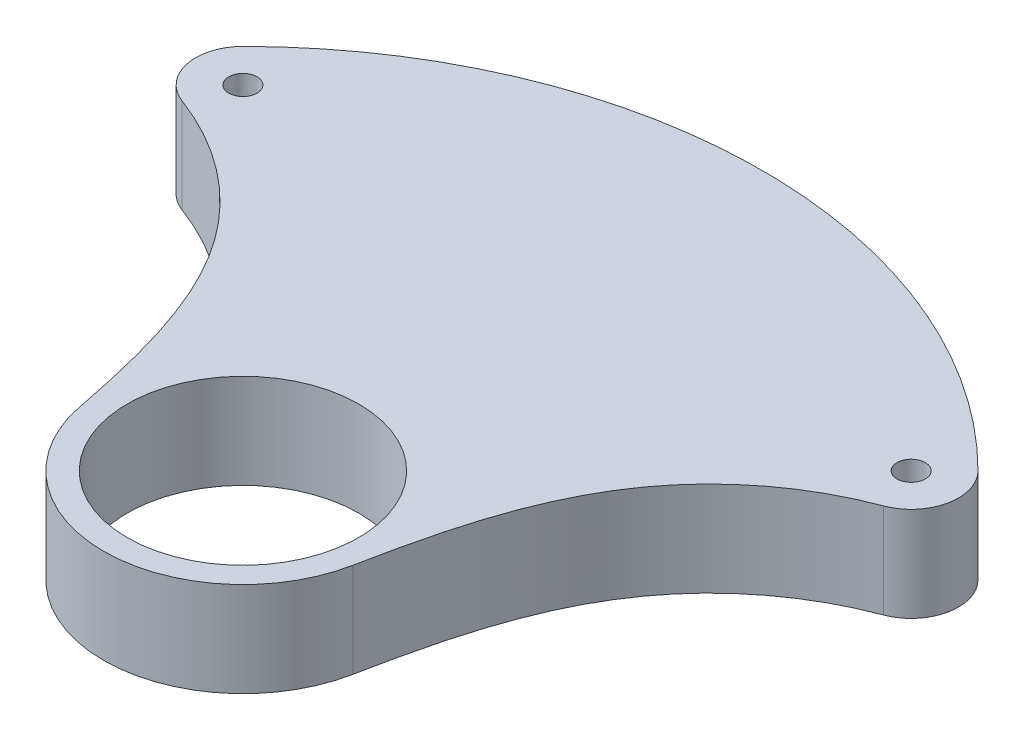
from build123d import *

# Parameters (mm, degrees)
SKETCH2_R           = 12.25
BOSS_EXTRUDE1_DEPTH = 10
CUT_EXTRUDE1_REACH  = 70.946
SKETCH3_R           = 1.5


with BuildPart() as part:
    # Sketch2 → Boss-Extrude1 (new body)
    # profile 1 of 6: a face of its own
    with BuildSketch(Plane(origin=(0, 0, 0), x_dir=(1, 0, 0), z_dir=(0, 1, 0))):
        with BuildLine():
            ThreePointArc((-37.10126952, 30.670072063), (-34.291787618, 30.469762498), (-31.819805153, 31.819805153))
            Line((-31.819805153, 31.819805153), (-38.890872965, 38.890872965))
            ThreePointArc((-38.890872965, 38.890872965), (-40.24091562, 34.291787618), (-37.10126952, 30.670072063))
        make_face()
    # profile 2 of 6: a face of its own
    with BuildSketch(Plane(origin=(0, 0, 0), x_dir=(1, 0, 0), z_dir=(0, 1, 0))):
        with BuildLine():
            Line((-38.890872965, 38.890872965), (-31.819805153, 31.819805153))
            ThreePointArc((-31.819805153, 31.819805153), (0, 45), (31.819805153, 31.819805153))
            ThreePointArc((31.819805153, 31.819805153), (34.291787618, 30.469762498), (37.10126952, 30.670072063))
            ThreePointArc((37.10126952, 30.670072063), (40.24091562, 34.291787618), (38.890872965, 38.890872965))
            ThreePointArc((38.890872965, 38.890872965), (0, 55), (-38.890872965, 38.890872965))
        make_face()
    # profile 3 of 6: a face of its own
    with BuildSketch(Plane(origin=(0, 0, 0), x_dir=(1, 0, 0), z_dir=(0, 1, 0))):
        with BuildLine():
            ThreePointArc((31.819805153, 31.819805153), (0, 45), (-31.819805153, 31.819805153))
            ThreePointArc((-31.819805153, 31.819805153), (-32.980620877, 30.615006885), (-34.095849533, 29.367891389))
            add(Edge.make_bspline(
                [(-34.095849533, 29.367891389), (-29.412092921, 27.041011889), (-19.283887533, 18.248514738), (-16.048568895, 5.169213632), (-14.472968185, -2.845292938)],
                knots=[0.074524007, 0.074524007, 0.074524007, 0.074524007, 0.434164212, 1, 1, 1, 1], degree=3))
            ThreePointArc((-14.472968185, -2.845292938), (-1.42937386, 14.68057868), (14.75, 0))
            ThreePointArc((14.75, 0), (14.68057868, -1.42937386), (14.472968185, -2.845292938))
            add(Edge.make_bspline(
                [(34.095849533, 29.367891389), (29.412092921, 27.041011889), (19.283887533, 18.248514738), (16.048568895, 5.169213632), (14.472968185, -2.845292938)],
                knots=[0.074524007, 0.074524007, 0.074524007, 0.074524007, 0.434164212, 1, 1, 1, 1], degree=3))
            ThreePointArc((34.095849533, 29.367891389), (32.980620877, 30.615006885), (31.819805153, 31.819805153))
        make_face()
    # profile 4 of 6: a face of its own
    with BuildSketch(Plane(origin=(0, 0, 0), x_dir=(1, 0, 0), z_dir=(0, 1, 0))):
        with BuildLine():
            ThreePointArc((-34.095849533, 29.367891389), (-32.980620877, 30.615006885), (-31.819805153, 31.819805153))
            ThreePointArc((-31.819805153, 31.819805153), (-34.291787618, 30.469762498), (-37.10126952, 30.670072063))
            add(Edge.make_bspline(
                [(-37.10126952, 30.670072063), (-36.069084867, 30.285436005), (-35.066409295, 29.850063244), (-34.095849533, 29.367891389)],
                knots=[0, 0, 0, 0, 0.074524007, 0.074524007, 0.074524007, 0.074524007], degree=3))
        make_face()
    # profile 5 of 6: a face of its own
    with BuildSketch(Plane(origin=(0, 0, 0), x_dir=(1, 0, 0), z_dir=(0, 1, 0))):
        with BuildLine():
            ThreePointArc((37.10126952, 30.670072063), (34.291787618, 30.469762498), (31.819805153, 31.819805153))
            ThreePointArc((31.819805153, 31.819805153), (32.980620877, 30.615006885), (34.095849533, 29.367891389))
            add(Edge.make_bspline(
                [(37.10126952, 30.670072063), (36.069084867, 30.285436005), (35.066409295, 29.850063244), (34.095849533, 29.367891389)],
                knots=[0, 0, 0, 0, 0.074524007, 0.074524007, 0.074524007, 0.074524007], degree=3))
        make_face()
    # profile 6 of 6: a face of its own
    with BuildSketch(Plane(origin=(0, 0, 0), x_dir=(1, 0, 0), z_dir=(0, 1, 0))):
        with BuildLine():
            ThreePointArc((14.75, 0), (-1.42937386, 14.68057868), (-14.472968185, -2.845292938))
            ThreePointArc((-14.472968185, -2.845292938), (0, -14.75), (14.472968185, -2.845292938))
            ThreePointArc((14.472968185, -2.845292938), (14.68057868, -1.42937386), (14.75, 0))
        make_face()
        with Locations(Location((0, 0, 0), (0, 0, 270))):
            Circle(SKETCH2_R, mode=Mode.SUBTRACT)
    extrude(amount=BOSS_EXTRUDE1_DEPTH)

    # Sketch3 → Cut-Extrude1 (cut, up to next)
    with BuildSketch(Plane(origin=(0, 10, 0), x_dir=(1, 0, 0), z_dir=(0, 1, 0)), mode=Mode.PRIVATE) as cut_extrude1_sk1:
        with Locations(Location((-35.355339059, 35.355339059, 0), (0, 0, 270))):
            Circle(SKETCH3_R)
    cut_extrude1_tool1 = extrude(cut_extrude1_sk1.sketch, amount=-CUT_EXTRUDE1_REACH, mode=Mode.PRIVATE) & part.part
    # Sketch3 → Cut-Extrude1 (cut, up to next)
    with BuildSketch(Plane(origin=(0, 10, 0), x_dir=(1, 0, 0), z_dir=(0, 1, 0)), mode=Mode.PRIVATE) as cut_extrude1_sk2:
        with Locations(Location((35.355339059, 35.355339059, 0), (0, 0, 270))):
            Circle(SKETCH3_R)
    cut_extrude1_tool2 = extrude(cut_extrude1_sk2.sketch, amount=-CUT_EXTRUDE1_REACH, mode=Mode.PRIVATE) & part.part
    add(cut_extrude1_tool1.solids().sort_by_distance((-35.355339, 10, -35.355339))[0], mode=Mode.SUBTRACT)
    add(cut_extrude1_tool2.solids().sort_by_distance((35.355339, 10, -35.355339))[0], mode=Mode.SUBTRACT)


solid = part.part
